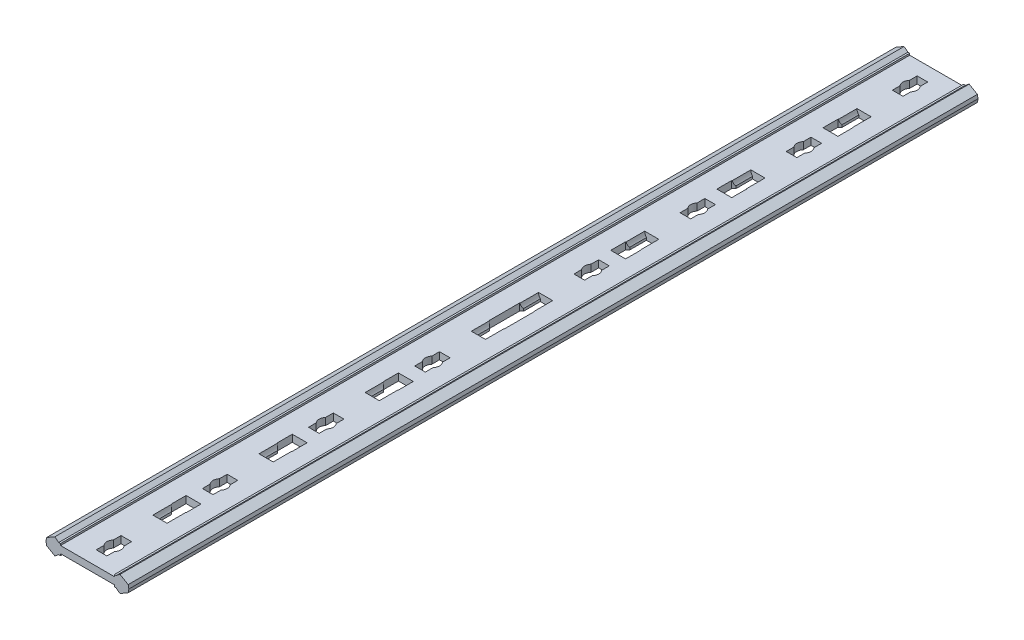
from build123d import *

# Parameters (mm, degrees)
EXTRUDE_1_DEPTH          = 120
CUT_EXTRUDE_1_REACH      = 122.615
SKETCH_2_W               = 4.2
SKETCH_2_H               = 9.5
EXTRUDE_2_DEPTH          = 5.3
CUT_EXTRUDE_2_REACH      = 122.615
PATTERN_LINEAR_1_COUNT   = 4
PATTERN_LINEAR_1_PITCH   = 30
MIRROR_1_COPY_1_REACH    = 122.615
MIRROR_1_COPY_1_SKETCH_W = 4.2
MIRROR_1_COPY_1_SKETCH_H = 9.5
MIRROR_1_COPY_2_REACH    = 122.615
MIRROR_1_COPY_2_SKETCH_W = 4.2
MIRROR_1_COPY_2_SKETCH_H = 9.5
MIRROR_1_COPY_3_REACH    = 122.615
MIRROR_1_COPY_3_SKETCH_W = 4.2
MIRROR_1_COPY_3_SKETCH_H = 9.5
MIRROR_1_COPY_4_DEPTH    = 5.3
MIRROR_1_COPY_5_DEPTH    = 5.3
MIRROR_1_COPY_6_DEPTH    = 5.3
MIRROR_1_COPY_7_REACH    = 122.615
MIRROR_1_COPY_8_REACH    = 122.615
MIRROR_1_COPY_9_REACH    = 122.615


with BuildPart() as part:
    # 草图1 → 凸台-拉伸1 (new body)
    with BuildSketch(Plane.XY):
        Polygon((-11.7, 0), (-11.523673019, 1), (-9.2, 2.341573243), (-8.1, 1.5), (-7.6, 1.5), (-7.6, 1), (7.6, 1), (7.6, 1.5), (8.1, 1.5), (9.2, 2.341573243), (11.523673019, 1), (11.7, 0), (11.523673019, -1), (9.2, -2.341573243), (8.1, -1.5), (7.6, -1.5), (7.6, -1), (-7.6, -1), (-7.6, -1.5), (-8.1, -1.5), (-9.2, -2.341573243), (-11.523673019, -1), align=None)
    extrude_1 = extrude(amount=EXTRUDE_1_DEPTH)

    # 草图2 → 切除-拉伸1 (cut, up to next)
    with BuildSketch(Plane(origin=(0, 1, 0), x_dir=(1, 0, 0), z_dir=(0, 1, 0)), mode=Mode.PRIVATE) as cut_extrude_1_sk1:
        with Locations((0, -4.75)):
            Rectangle(SKETCH_2_W, SKETCH_2_H)
    cut_extrude_1_tool1 = extrude(cut_extrude_1_sk1.sketch, amount=-CUT_EXTRUDE_1_REACH, mode=Mode.PRIVATE) & part.part
    # 草图2 → 切除-拉伸1 (cut, up to next)
    with BuildSketch(Plane(origin=(0, 1, 0), x_dir=(1, 0, 0), z_dir=(0, 1, 0)), mode=Mode.PRIVATE) as cut_extrude_1_sk2:
        with BuildLine():
            Line((1.5, -19), (-1.5, -19))
            Line((-1.5, -19), (-1.5, -21.177124344))
            ThreePointArc((-1.5, -21.177124344), (-2, -22.5), (-1.5, -23.822875656))
            Line((-1.5, -23.822875656), (-1.5, -26))
            Line((-1.5, -26), (1.5, -26))
            Line((1.5, -26), (1.5, -23.822875656))
            ThreePointArc((1.5, -23.822875656), (2, -22.5), (1.5, -21.177124344))
            Line((1.5, -21.177124344), (1.5, -19))
        make_face()
    cut_extrude_1_tool2 = extrude(cut_extrude_1_sk2.sketch, amount=-CUT_EXTRUDE_1_REACH, mode=Mode.PRIVATE) & part.part
    cut_extrude_1_1 = cut_extrude_1_tool1.solids().sort_by_distance((0, 1, 4.75))[0]
    add(cut_extrude_1_1, mode=Mode.SUBTRACT)
    cut_extrude_1_2 = cut_extrude_1_tool2.solids().sort_by_distance((0, 1, 22.5))[0]
    add(cut_extrude_1_2, mode=Mode.SUBTRACT)
    cut_extrude_1 = cut_extrude_1_1 + cut_extrude_1_2  # 切除-拉伸1 as one shape, for the pattern or mirror that repeats it

    # 草图3 → 凸台-拉伸2 (add)
    with BuildSketch(Plane(origin=(0, 0, 9.5), x_dir=(-1, 0, 0), z_dir=(0, 0, -1))):
        with BuildLine():
            Line((-2, 1), (-2.1, 1))
            Line((-2.1, 1), (-2.1, -1))
            Line((-2.1, -1), (-1.5, -1))
            Line((-1.5, -1), (-1.5, -0.322875656))
            ThreePointArc((-1.5, -0.322875656), (-1.870828693, 0.292893219), (-2, 1))
        make_face()
        with BuildLine():
            Line((1.5, -1), (1.5, -0.322875656))
            ThreePointArc((1.5, -0.322875656), (1.870828693, 0.292893219), (2, 1))
            Line((2, 1), (2.1, 1))
            Line((2.1, 1), (2.1, -1))
            Line((2.1, -1), (1.5, -1))
        make_face()
    extrude_2 = extrude(amount=EXTRUDE_2_DEPTH)

    # 草图4 → 切除-拉伸2 (cut, up to next)
    with BuildSketch(Plane.XZ.offset(1), mode=Mode.PRIVATE) as cut_extrude_2_sk1:
        Polygon((-2.1, 4.2), (-1.5, 4.2), (-1.5, 4.8), align=None)
    cut_extrude_2_tool1 = extrude(cut_extrude_2_sk1.sketch, amount=-CUT_EXTRUDE_2_REACH, mode=Mode.PRIVATE) & part.part
    # 草图4 → 切除-拉伸2 (cut, up to next)
    with BuildSketch(Plane.XZ.offset(1), mode=Mode.PRIVATE) as cut_extrude_2_sk2:
        Polygon((1.5, 4.2), (2.1, 4.2), (1.5, 4.8), align=None)
    cut_extrude_2_tool2 = extrude(cut_extrude_2_sk2.sketch, amount=-CUT_EXTRUDE_2_REACH, mode=Mode.PRIVATE) & part.part
    cut_extrude_2_1 = cut_extrude_2_tool1.solids().sort_by_distance((-1.7, -1, 4.4))[0]
    add(cut_extrude_2_1, mode=Mode.SUBTRACT)
    cut_extrude_2_2 = cut_extrude_2_tool2.solids().sort_by_distance((1.7, -1, 4.4))[0]
    add(cut_extrude_2_2, mode=Mode.SUBTRACT)
    cut_extrude_2 = cut_extrude_2_1 + cut_extrude_2_2  # 切除-拉伸2 as one shape, for the pattern or mirror that repeats it

    # 阵列(线性)1: 切除-拉伸1, 凸台-拉伸2, 切除-拉伸2 ×4
    with Locations(*[(0, 0, i * PATTERN_LINEAR_1_PITCH) for i in range(1, PATTERN_LINEAR_1_COUNT)]):
        add(cut_extrude_1, mode=Mode.SUBTRACT)
        add(extrude_2)
        add(cut_extrude_2, mode=Mode.SUBTRACT)

    # 镜向1: 凸台-拉伸1, 切除-拉伸1, 凸台-拉伸2, 切除-拉伸2 across plane
    add(extrude_1.mirror(Plane.XY))
    add(cut_extrude_1.mirror(Plane.XY), mode=Mode.SUBTRACT)
    add(extrude_2.mirror(Plane.XY))
    add(cut_extrude_2.mirror(Plane.XY), mode=Mode.SUBTRACT)

    # 镜向1 copy 1 sketch → 镜向1 copy 1 (cut, up to next)
    with BuildSketch(Plane(origin=(0, 1, -30), x_dir=(1, 0, 0), z_dir=(0, 1, 0)), mode=Mode.PRIVATE) as mirror_1_copy_1_sk1:
        with Locations((0, 4.75)):
            Rectangle(MIRROR_1_COPY_1_SKETCH_W, MIRROR_1_COPY_1_SKETCH_H)
    mirror_1_copy_1_tool1 = extrude(mirror_1_copy_1_sk1.sketch, amount=-MIRROR_1_COPY_1_REACH, mode=Mode.PRIVATE) & part.part
    # 镜向1 copy 1 sketch → 镜向1 copy 1 (cut, up to next)
    with BuildSketch(Plane(origin=(0, 1, -30), x_dir=(1, 0, 0), z_dir=(0, 1, 0)), mode=Mode.PRIVATE) as mirror_1_copy_1_sk2:
        with BuildLine():
            Line((1.5, 19), (-1.5, 19))
            Line((-1.5, 19), (-1.5, 21.177124344))
            ThreePointArc((-1.5, 21.177124344), (-2, 22.5), (-1.5, 23.822875656))
            Line((-1.5, 23.822875656), (-1.5, 26))
            Line((-1.5, 26), (1.5, 26))
            Line((1.5, 26), (1.5, 23.822875656))
            ThreePointArc((1.5, 23.822875656), (2, 22.5), (1.5, 21.177124344))
            Line((1.5, 21.177124344), (1.5, 19))
        make_face()
    mirror_1_copy_1_tool2 = extrude(mirror_1_copy_1_sk2.sketch, amount=-MIRROR_1_COPY_1_REACH, mode=Mode.PRIVATE) & part.part
    add(mirror_1_copy_1_tool1.solids().sort_by_distance((0, 1, -34.75))[0], mode=Mode.SUBTRACT)
    add(mirror_1_copy_1_tool2.solids().sort_by_distance((0, 1, -52.5))[0], mode=Mode.SUBTRACT)

    # 镜向1 copy 2 sketch → 镜向1 copy 2 (cut, up to next)
    with BuildSketch(Plane(origin=(0, 1, -60), x_dir=(1, 0, 0), z_dir=(0, 1, 0)), mode=Mode.PRIVATE) as mirror_1_copy_2_sk1:
        with Locations((0, 4.75)):
            Rectangle(MIRROR_1_COPY_2_SKETCH_W, MIRROR_1_COPY_2_SKETCH_H)
    mirror_1_copy_2_tool1 = extrude(mirror_1_copy_2_sk1.sketch, amount=-MIRROR_1_COPY_2_REACH, mode=Mode.PRIVATE) & part.part
    # 镜向1 copy 2 sketch → 镜向1 copy 2 (cut, up to next)
    with BuildSketch(Plane(origin=(0, 1, -60), x_dir=(1, 0, 0), z_dir=(0, 1, 0)), mode=Mode.PRIVATE) as mirror_1_copy_2_sk2:
        with BuildLine():
            Line((1.5, 19), (-1.5, 19))
            Line((-1.5, 19), (-1.5, 21.177124344))
            ThreePointArc((-1.5, 21.177124344), (-2, 22.5), (-1.5, 23.822875656))
            Line((-1.5, 23.822875656), (-1.5, 26))
            Line((-1.5, 26), (1.5, 26))
            Line((1.5, 26), (1.5, 23.822875656))
            ThreePointArc((1.5, 23.822875656), (2, 22.5), (1.5, 21.177124344))
            Line((1.5, 21.177124344), (1.5, 19))
        make_face()
    mirror_1_copy_2_tool2 = extrude(mirror_1_copy_2_sk2.sketch, amount=-MIRROR_1_COPY_2_REACH, mode=Mode.PRIVATE) & part.part
    add(mirror_1_copy_2_tool1.solids().sort_by_distance((0, 1, -64.75))[0], mode=Mode.SUBTRACT)
    add(mirror_1_copy_2_tool2.solids().sort_by_distance((0, 1, -82.5))[0], mode=Mode.SUBTRACT)

    # 镜向1 copy 3 sketch → 镜向1 copy 3 (cut, up to next)
    with BuildSketch(Plane(origin=(0, 1, -90), x_dir=(1, 0, 0), z_dir=(0, 1, 0)), mode=Mode.PRIVATE) as mirror_1_copy_3_sk1:
        with Locations((0, 4.75)):
            Rectangle(MIRROR_1_COPY_3_SKETCH_W, MIRROR_1_COPY_3_SKETCH_H)
    mirror_1_copy_3_tool1 = extrude(mirror_1_copy_3_sk1.sketch, amount=-MIRROR_1_COPY_3_REACH, mode=Mode.PRIVATE) & part.part
    # 镜向1 copy 3 sketch → 镜向1 copy 3 (cut, up to next)
    with BuildSketch(Plane(origin=(0, 1, -90), x_dir=(1, 0, 0), z_dir=(0, 1, 0)), mode=Mode.PRIVATE) as mirror_1_copy_3_sk2:
        with BuildLine():
            Line((1.5, 19), (-1.5, 19))
            Line((-1.5, 19), (-1.5, 21.177124344))
            ThreePointArc((-1.5, 21.177124344), (-2, 22.5), (-1.5, 23.822875656))
            Line((-1.5, 23.822875656), (-1.5, 26))
            Line((-1.5, 26), (1.5, 26))
            Line((1.5, 26), (1.5, 23.822875656))
            ThreePointArc((1.5, 23.822875656), (2, 22.5), (1.5, 21.177124344))
            Line((1.5, 21.177124344), (1.5, 19))
        make_face()
    mirror_1_copy_3_tool2 = extrude(mirror_1_copy_3_sk2.sketch, amount=-MIRROR_1_COPY_3_REACH, mode=Mode.PRIVATE) & part.part
    add(mirror_1_copy_3_tool1.solids().sort_by_distance((0, 1, -94.75))[0], mode=Mode.SUBTRACT)
    add(mirror_1_copy_3_tool2.solids().sort_by_distance((0, 1, -112.5))[0], mode=Mode.SUBTRACT)

    # 镜向1 copy 4 sketch → 镜向1 copy 4 (add)
    with BuildSketch(Plane(origin=(0, 0, -39.5), x_dir=(-1, 0, 0), z_dir=(0, 0, 1))):
        with BuildLine():
            Line((-2, -1), (-2.1, -1))
            Line((-2.1, -1), (-2.1, 1))
            Line((-2.1, 1), (-1.5, 1))
            Line((-1.5, 1), (-1.5, 0.322875656))
            ThreePointArc((-1.5, 0.322875656), (-1.870828693, -0.292893219), (-2, -1))
        make_face()
        with BuildLine():
            Line((1.5, 1), (1.5, 0.322875656))
            ThreePointArc((1.5, 0.322875656), (1.870828693, -0.292893219), (2, -1))
            Line((2, -1), (2.1, -1))
            Line((2.1, -1), (2.1, 1))
            Line((2.1, 1), (1.5, 1))
        make_face()
    extrude(amount=MIRROR_1_COPY_4_DEPTH)

    # 镜向1 copy 5 sketch → 镜向1 copy 5 (add)
    with BuildSketch(Plane(origin=(0, 0, -69.5), x_dir=(-1, 0, 0), z_dir=(0, 0, 1))):
        with BuildLine():
            Line((-2, -1), (-2.1, -1))
            Line((-2.1, -1), (-2.1, 1))
            Line((-2.1, 1), (-1.5, 1))
            Line((-1.5, 1), (-1.5, 0.322875656))
            ThreePointArc((-1.5, 0.322875656), (-1.870828693, -0.292893219), (-2, -1))
        make_face()
        with BuildLine():
            Line((1.5, 1), (1.5, 0.322875656))
            ThreePointArc((1.5, 0.322875656), (1.870828693, -0.292893219), (2, -1))
            Line((2, -1), (2.1, -1))
            Line((2.1, -1), (2.1, 1))
            Line((2.1, 1), (1.5, 1))
        make_face()
    extrude(amount=MIRROR_1_COPY_5_DEPTH)

    # 镜向1 copy 6 sketch → 镜向1 copy 6 (add)
    with BuildSketch(Plane(origin=(0, 0, -99.5), x_dir=(-1, 0, 0), z_dir=(0, 0, 1))):
        with BuildLine():
            Line((-2, -1), (-2.1, -1))
            Line((-2.1, -1), (-2.1, 1))
            Line((-2.1, 1), (-1.5, 1))
            Line((-1.5, 1), (-1.5, 0.322875656))
            ThreePointArc((-1.5, 0.322875656), (-1.870828693, -0.292893219), (-2, -1))
        make_face()
        with BuildLine():
            Line((1.5, 1), (1.5, 0.322875656))
            ThreePointArc((1.5, 0.322875656), (1.870828693, -0.292893219), (2, -1))
            Line((2, -1), (2.1, -1))
            Line((2.1, -1), (2.1, 1))
            Line((2.1, 1), (1.5, 1))
        make_face()
    extrude(amount=MIRROR_1_COPY_6_DEPTH)

    # 镜向1 copy 7 sketch → 镜向1 copy 7 (cut, up to next)
    with BuildSketch(Plane(origin=(0, -1, -30), x_dir=(1, 0, 0), z_dir=(0, -1, 0)), mode=Mode.PRIVATE) as mirror_1_copy_7_sk1:
        Polygon((-2.1, -4.2), (-1.5, -4.2), (-1.5, -4.8), align=None)
    mirror_1_copy_7_tool1 = extrude(mirror_1_copy_7_sk1.sketch, amount=-MIRROR_1_COPY_7_REACH, mode=Mode.PRIVATE) & part.part
    # 镜向1 copy 7 sketch → 镜向1 copy 7 (cut, up to next)
    with BuildSketch(Plane(origin=(0, -1, -30), x_dir=(1, 0, 0), z_dir=(0, -1, 0)), mode=Mode.PRIVATE) as mirror_1_copy_7_sk2:
        Polygon((1.5, -4.2), (2.1, -4.2), (1.5, -4.8), align=None)
    mirror_1_copy_7_tool2 = extrude(mirror_1_copy_7_sk2.sketch, amount=-MIRROR_1_COPY_7_REACH, mode=Mode.PRIVATE) & part.part
    add(mirror_1_copy_7_tool1.solids().sort_by_distance((-1.7, -1, -34.4))[0], mode=Mode.SUBTRACT)
    add(mirror_1_copy_7_tool2.solids().sort_by_distance((1.7, -1, -34.4))[0], mode=Mode.SUBTRACT)

    # 镜向1 copy 8 sketch → 镜向1 copy 8 (cut, up to next)
    with BuildSketch(Plane(origin=(0, -1, -60), x_dir=(1, 0, 0), z_dir=(0, -1, 0)), mode=Mode.PRIVATE) as mirror_1_copy_8_sk1:
        Polygon((-2.1, -4.2), (-1.5, -4.2), (-1.5, -4.8), align=None)
    mirror_1_copy_8_tool1 = extrude(mirror_1_copy_8_sk1.sketch, amount=-MIRROR_1_COPY_8_REACH, mode=Mode.PRIVATE) & part.part
    # 镜向1 copy 8 sketch → 镜向1 copy 8 (cut, up to next)
    with BuildSketch(Plane(origin=(0, -1, -60), x_dir=(1, 0, 0), z_dir=(0, -1, 0)), mode=Mode.PRIVATE) as mirror_1_copy_8_sk2:
        Polygon((1.5, -4.2), (2.1, -4.2), (1.5, -4.8), align=None)
    mirror_1_copy_8_tool2 = extrude(mirror_1_copy_8_sk2.sketch, amount=-MIRROR_1_COPY_8_REACH, mode=Mode.PRIVATE) & part.part
    add(mirror_1_copy_8_tool1.solids().sort_by_distance((-1.7, -1, -64.4))[0], mode=Mode.SUBTRACT)
    add(mirror_1_copy_8_tool2.solids().sort_by_distance((1.7, -1, -64.4))[0], mode=Mode.SUBTRACT)

    # 镜向1 copy 9 sketch → 镜向1 copy 9 (cut, up to next)
    with BuildSketch(Plane(origin=(0, -1, -90), x_dir=(1, 0, 0), z_dir=(0, -1, 0)), mode=Mode.PRIVATE) as mirror_1_copy_9_sk1:
        Polygon((-2.1, -4.2), (-1.5, -4.2), (-1.5, -4.8), align=None)
    mirror_1_copy_9_tool1 = extrude(mirror_1_copy_9_sk1.sketch, amount=-MIRROR_1_COPY_9_REACH, mode=Mode.PRIVATE) & part.part
    # 镜向1 copy 9 sketch → 镜向1 copy 9 (cut, up to next)
    with BuildSketch(Plane(origin=(0, -1, -90), x_dir=(1, 0, 0), z_dir=(0, -1, 0)), mode=Mode.PRIVATE) as mirror_1_copy_9_sk2:
        Polygon((1.5, -4.2), (2.1, -4.2), (1.5, -4.8), align=None)
    mirror_1_copy_9_tool2 = extrude(mirror_1_copy_9_sk2.sketch, amount=-MIRROR_1_COPY_9_REACH, mode=Mode.PRIVATE) & part.part
    add(mirror_1_copy_9_tool1.solids().sort_by_distance((-1.7, -1, -94.4))[0], mode=Mode.SUBTRACT)
    add(mirror_1_copy_9_tool2.solids().sort_by_distance((1.7, -1, -94.4))[0], mode=Mode.SUBTRACT)


solid = part.part
